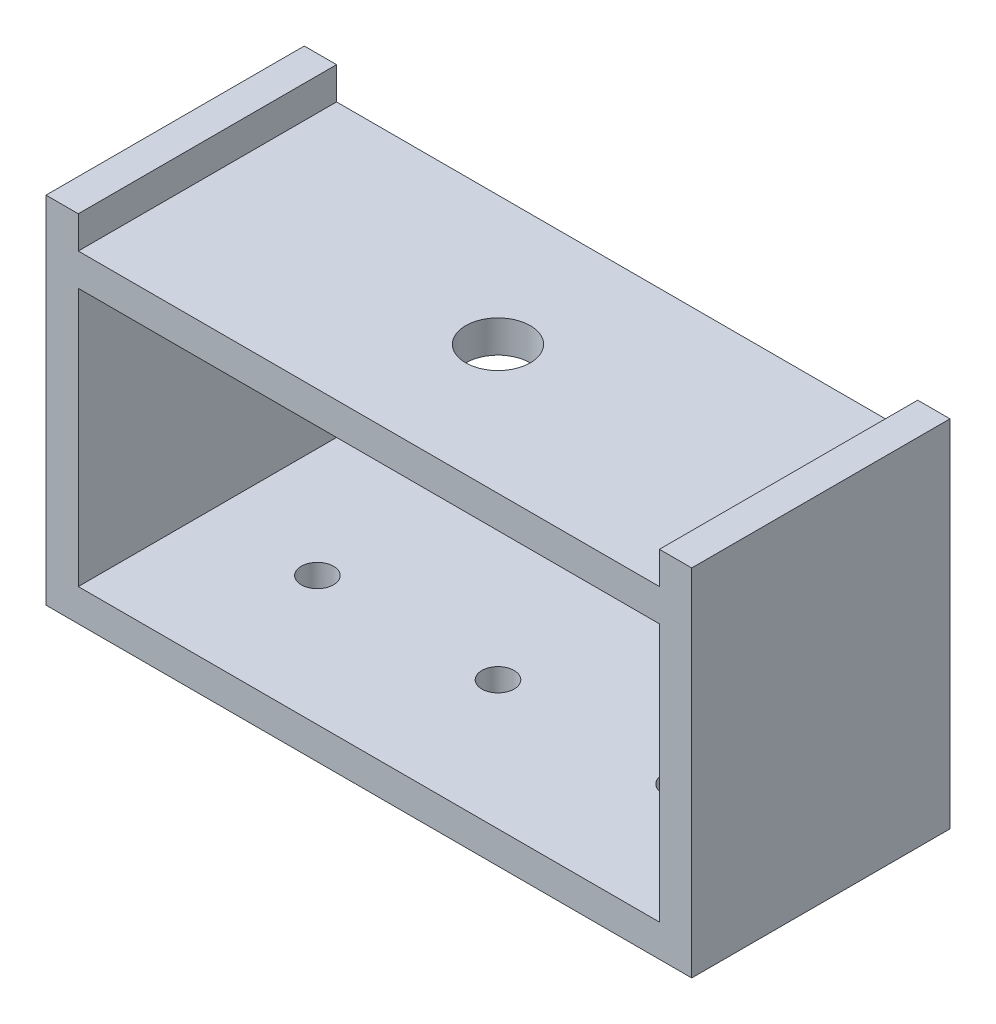
from build123d import *

# Parameters (mm, degrees)
SKETCH1_W               = 50.8
SKETCH1_H               = 63.5
BOSS_EXTRUDE1_DEPTH     = 127
SKETCH2_W               = 6.35
SKETCH2_H               = 50.8
BOSS_EXTRUDE2_DEPTH     = 6.35
CUT_EXTRUDE2_DEPTH      = 136.002851822
CUT_EXTRUDE2_DEPTH_BACK = 136.002851822
SKETCH4_W               = 114.3
SKETCH4_H               = 50.8
CUT_EXTRUDE3_REACH      = 146.244
SKETCH5_R               = 6.35
CUT_EXTRUDE4_REACH      = 146.244
SKETCH6_R               = 3.175


with BuildPart() as part:
    # Sketch1 → Boss-Extrude1 (new body)
    with BuildSketch(Plane(origin=(0, 0, 0), x_dir=(0, 0, -1), z_dir=(1, 0, 0))):
        Rectangle(SKETCH1_W, SKETCH1_H)
    extrude(amount=BOSS_EXTRUDE1_DEPTH)

    # Sketch2 → Boss-Extrude2 (add)
    with BuildSketch(Plane(origin=(0, 31.75, 0), x_dir=(1, 0, 0), z_dir=(0, 1, 0))):
        with Locations((123.825, 0)):
            Rectangle(SKETCH2_W, SKETCH2_H)
        with Locations((3.175, 0)):
            Rectangle(SKETCH2_W, SKETCH2_H)
    extrude(amount=BOSS_EXTRUDE2_DEPTH)

    # Sketch4 → Cut-Extrude2 (cut, two sides: drawn at the far end of the back side and taken through both)
    with BuildSketch(Plane.XY.offset(-CUT_EXTRUDE2_DEPTH_BACK)):
        with Locations((63.5, 0)):
            Rectangle(SKETCH4_W, SKETCH4_H)
    extrude(amount=CUT_EXTRUDE2_DEPTH + CUT_EXTRUDE2_DEPTH_BACK, mode=Mode.SUBTRACT)

    # Sketch5 → Cut-Extrude3 (cut, up to next)
    with BuildSketch(Plane(origin=(0, 31.75, 0), x_dir=(1, 0, 0), z_dir=(0, 1, 0)), mode=Mode.PRIVATE) as cut_extrude3_sk1:
        with Locations(Location((63.5, 0, 0), (0, 0, 270))):
            Circle(SKETCH5_R)
    cut_extrude3_tool1 = extrude(cut_extrude3_sk1.sketch, amount=-CUT_EXTRUDE3_REACH, mode=Mode.PRIVATE) & part.part
    add(cut_extrude3_tool1.solids().sort_by_distance((63.5, 31.75, 0))[0], mode=Mode.SUBTRACT)

    # Sketch6 → Cut-Extrude4 (cut, up to next)
    with BuildSketch(Plane(origin=(0, -25.4, 0), x_dir=(1, 0, 0), z_dir=(0, 1, 0)), mode=Mode.PRIVATE) as cut_extrude4_sk1:
        with Locations(Location((63.5, 0, 0), (0, 0, 180))):
            Circle(SKETCH6_R)
    cut_extrude4_tool1 = extrude(cut_extrude4_sk1.sketch, amount=-CUT_EXTRUDE4_REACH, mode=Mode.PRIVATE) & part.part
    # Sketch6 → Cut-Extrude4 (cut, up to next)
    with BuildSketch(Plane(origin=(0, -25.4, 0), x_dir=(1, 0, 0), z_dir=(0, 1, 0)), mode=Mode.PRIVATE) as cut_extrude4_sk2:
        with Locations(Location((27.983351472, 0, 0), (0, 0, 180))):
            Circle(SKETCH6_R)
    cut_extrude4_tool2 = extrude(cut_extrude4_sk2.sketch, amount=-CUT_EXTRUDE4_REACH, mode=Mode.PRIVATE) & part.part
    # Sketch6 → Cut-Extrude4 (cut, up to next)
    with BuildSketch(Plane(origin=(0, -25.4, 0), x_dir=(1, 0, 0), z_dir=(0, 1, 0)), mode=Mode.PRIVATE) as cut_extrude4_sk3:
        with Locations(Location((99.016648528, 0, 0), (0, 0, 270))):
            Circle(SKETCH6_R)
    cut_extrude4_tool3 = extrude(cut_extrude4_sk3.sketch, amount=-CUT_EXTRUDE4_REACH, mode=Mode.PRIVATE) & part.part
    add(cut_extrude4_tool1.solids().sort_by_distance((63.5, -25.4, 0))[0], mode=Mode.SUBTRACT)
    add(cut_extrude4_tool2.solids().sort_by_distance((27.983351, -25.4, 0))[0], mode=Mode.SUBTRACT)
    add(cut_extrude4_tool3.solids().sort_by_distance((99.016649, -25.4, 0))[0], mode=Mode.SUBTRACT)


solid = part.part
